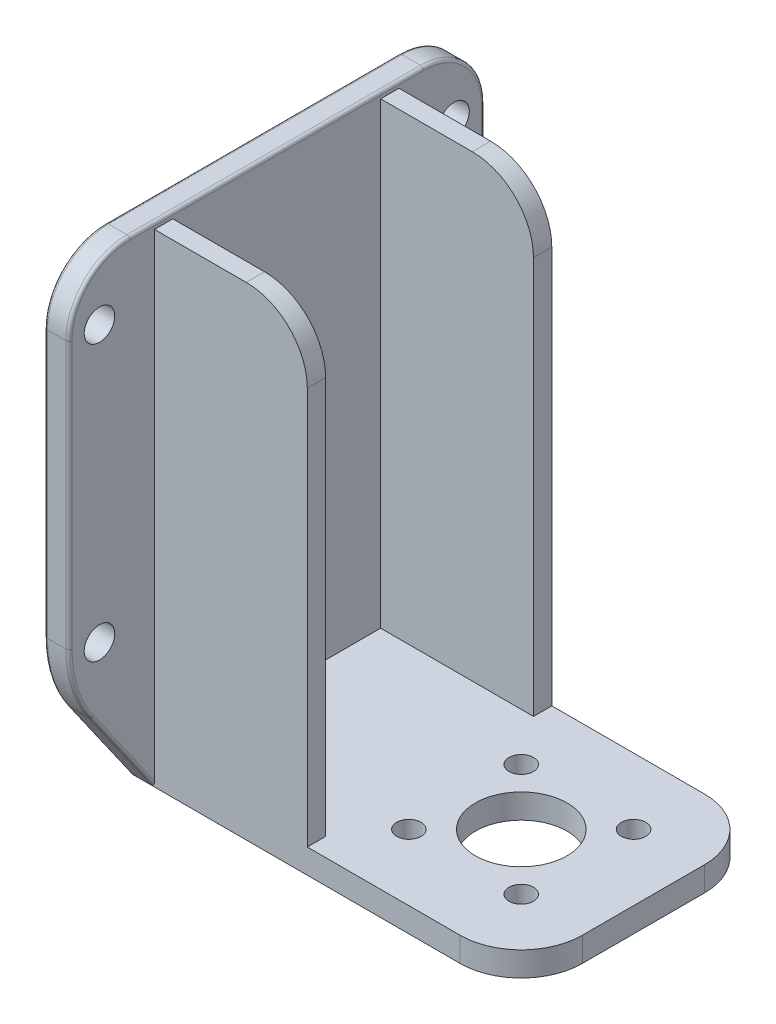
from build123d import *

# Parameters (mm, degrees)
SKETCH_1_W          = 60
SKETCH_1_H          = 40
SKETCH_1_R          = 7.5
SKETCH_1_R_2        = 2
EXTRUDE_1_DEPTH     = 4
EXTRUDE_2_DEPTH     = 4
SKETCH_6_W          = 4
SKETCH_6_H          = 68.008301528
EXTRUDE_3_DEPTH     = 60
SKETCH_7_R          = 2.5
CUT_EXTRUDE_1_DEPTH = 114.512737176
FILLET_1_R          = 10
FILLET_2_R          = 20
FILLET_4_R          = 10
FILLET_12_R         = 0.5
FILLET_13_R         = 0.5
SKETCH_10_W         = 25
SKETCH_10_H         = 3
EXTRUDE_6_DEPTH     = 75
FILLET_16_R         = 10


with BuildPart() as part:
    # 草图1 → 凸台-拉伸1 (new body)
    with BuildSketch(Plane(origin=(0, 0, 0), x_dir=(1, 0, 0), z_dir=(0, 1, 0))):
        with Locations((-43.629618652, 19.709362445)):
            Rectangle(SKETCH_1_W, SKETCH_1_H)
        with Locations(Location((-33.629618652, 19.709362445, 0), (0, 0, 270))):
            Circle(SKETCH_1_R, mode=Mode.SUBTRACT)
        with Locations(Location((-42.822006808, 28.9017506, 0), (0, 0, 270))):
            Circle(SKETCH_1_R_2, mode=Mode.SUBTRACT)
        with Locations(Location((-24.437230497, 28.9017506, 0), (0, 0, 270))):
            Circle(SKETCH_1_R_2, mode=Mode.SUBTRACT)
        with Locations(Location((-24.437230497, 10.516974289, 0), (0, 0, 270))):
            Circle(SKETCH_1_R_2, mode=Mode.SUBTRACT)
        with Locations(Location((-42.822006808, 10.516974289, 0), (0, 0, 270))):
            Circle(SKETCH_1_R_2, mode=Mode.SUBTRACT)
    extrude(amount=EXTRUDE_1_DEPTH)

    # 草图2 → 凸台-拉伸2 (add)
    with BuildSketch(Plane.ZY.offset(73.629618652)):
        Polygon((-53.713513209, 20), (-39.709362445, 0), (0.290637555, 0), (14.294788319, 20), align=None)
    extrude(amount=EXTRUDE_2_DEPTH)

    # 草图6 → 凸台-拉伸3 (add)
    with BuildSketch(Plane(origin=(0, 20, 0), x_dir=(1, 0, 0), z_dir=(0, 1, 0))):
        with Locations((-75.629618652, 19.709362445)):
            Rectangle(SKETCH_6_W, SKETCH_6_H)
    extrude(amount=EXTRUDE_3_DEPTH)

    # 草图7 → 切除-拉伸1 (cut, through all)
    with BuildSketch(Plane(origin=(-73.629618652, 0, 0), x_dir=(0, 0, -1), z_dir=(1, 0, 0))):
        with Locations((48.713513209, 25)):
            Circle(SKETCH_7_R)
        with Locations((-9.286486791, 25)):
            Circle(SKETCH_7_R)
        with Locations((48.713513209, 70)):
            Circle(SKETCH_7_R)
        with Locations((-9.286486791, 70)):
            Circle(SKETCH_7_R)
    extrude(amount=-CUT_EXTRUDE_1_DEPTH, mode=Mode.SUBTRACT)

    # 圆角1
    fillet_1_edges = [part.edges().sort_by_distance(p)[0] for p in [
        (-13.629618652, 2, -39.709362445),
        (-13.629618652, 2, 0.290637555),
    ]]
    fillet(fillet_1_edges, radius=FILLET_1_R)

    # 圆角2
    fillet_2_edges = [part.edges().sort_by_distance(p)[0] for p in [
        (-75.629618652, 20, 14.294788319),
        (-75.629618652, 20, -53.713513209),
    ]]
    fillet(fillet_2_edges, radius=FILLET_2_R)

    # 圆角4
    fillet_4_edges = [part.edges().sort_by_distance(p)[0] for p in [
        (-75.629618652, 80, -53.713513209),
        (-75.629618652, 80, 14.294788319),
    ]]
    fillet(fillet_4_edges, radius=FILLET_4_R)

    # 圆角12
    fillet_12_edges = [part.edges().sort_by_distance(p)[0] for p in [
        (-73.629618652, 80, -19.709362445),
        (-73.629618652, 48.152987889, -53.713513209),
        (-73.629618652, 48.152987889, 14.294788319),
        (-73.629618652, 77.071067812, -50.784581021),
        (-73.629618652, 77.071067812, 11.365856131),
        (-73.629618652, 7.417223525, 5.48423338),
        (-73.629618652, 7.417223525, -44.90295827),
        (-73.629618652, 20.291859787, 13.369127334),
        (-73.629618652, 20.291859787, -52.787852224),
    ]]
    fillet(fillet_12_edges, radius=FILLET_12_R)

    # 圆角13
    fillet_13_edges = [part.edges().sort_by_distance(p)[0] for p in [
        (-77.629618652, 80, -19.709362445),
        (-77.629618652, 48.152987889, 14.294788319),
        (-77.629618652, 48.152987889, -53.713513209),
        (-77.629618652, 77.071067812, -50.784581021),
        (-77.629618652, 77.071067812, 11.365856131),
        (-77.629618652, 7.417223525, 5.48423338),
        (-77.629618652, 7.417223525, -44.90295827),
        (-77.629618652, 20.291859787, 13.369127334),
        (-77.629618652, 20.291859787, -52.787852224),
    ]]
    fillet(fillet_13_edges, radius=FILLET_13_R)

    # 草图10 → 凸台-拉伸6 (add)
    with BuildSketch(Plane(origin=(0, 4, 0), x_dir=(1, 0, 0), z_dir=(0, 1, 0))):
        with Locations((-61.129618652, 38.209362445)):
            Rectangle(SKETCH_10_W, SKETCH_10_H)
        with Locations((-61.129618652, 1.209362445)):
            Rectangle(SKETCH_10_W, SKETCH_10_H)
    extrude(amount=EXTRUDE_6_DEPTH)

    # 圆角16
    fillet_16_edges = [part.edges().sort_by_distance(p)[0] for p in [
        (-48.629618652, 79, -38.209362445),
        (-48.629618652, 79, -1.209362445),
    ]]
    fillet(fillet_16_edges, radius=FILLET_16_R)


solid = part.part
